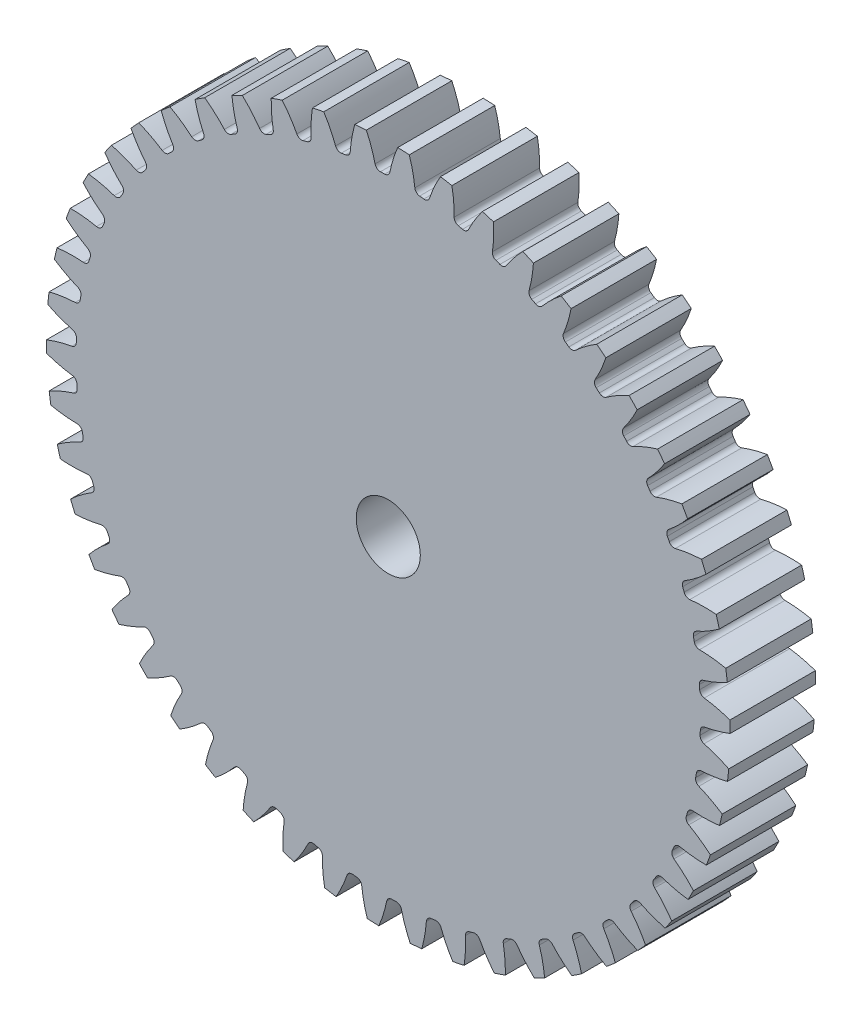
from build123d import *

# Parameters (mm, degrees)
SKETCH3_R         = 25.4
GEARBODY_DEPTH    = 6.35
TOOTHCUT_DEPTH    = 37.477972806
CIRPATTERN1_COUNT = 50
BOREDIA_R         = 2.38125
BORE_DEPTH        = 12700


with BuildPart() as part:
    # Sketch3 → gearBody (new body)
    with BuildSketch(Plane.XY):
        Circle(SKETCH3_R)
    extrude(amount=GEARBODY_DEPTH)

    # Sketch2 → toothCut (cut, through all)
    with BuildSketch(Plane.XY):
        with BuildLine():
            ThreePointArc((23.169316156, -1.192208523), (23.176961275, -1.032975487), (23.183512065, -0.873693678))
            ThreePointArc((23.183512065, -0.873693678), (23.28110412, -0.62774737), (23.511658753, -0.497907637))
            ThreePointArc((23.511658753, -0.497907637), (27.095252347, 0.903029303), (29.851217891, 3.588065853))
            ThreePointArc((29.851217891, 3.588065853), (30.036267074, -1.338688331), (29.413660568, -6.229446056))
            ThreePointArc((29.413660568, -6.229446056), (26.907486881, -3.309880882), (23.462731308, -1.595696994))
            ThreePointArc((23.462731308, -1.595696994), (23.244641534, -1.445861599), (23.169316156, -1.192208523))
        make_face()
    toothcut = extrude(amount=TOOTHCUT_DEPTH, mode=Mode.SUBTRACT)

    # CirPattern1: toothCut ×50 about axis
    cirpattern1_axis = Axis((0, 0, 6.35), (0, 0, -1))
    for i in range(1, CIRPATTERN1_COUNT):
        add(toothcut.rotate(cirpattern1_axis, i * 360 / CIRPATTERN1_COUNT), mode=Mode.SUBTRACT)

    # boreDia → bore (cut, symmetric)
    with BuildSketch(Plane.XY):
        Circle(BOREDIA_R)
    extrude(amount=BORE_DEPTH, both=True, mode=Mode.SUBTRACT)


solid = part.part
